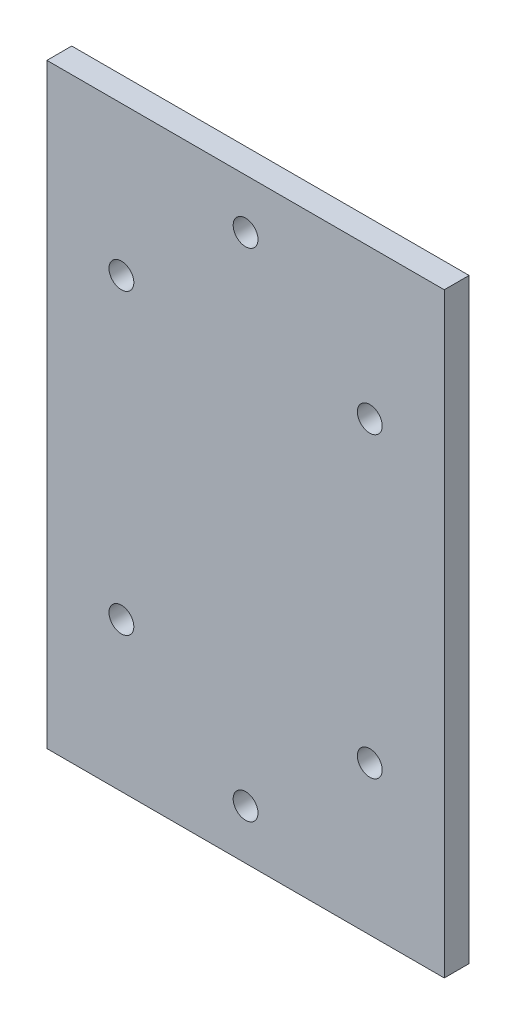
from build123d import *

# Parameters (mm, degrees)
SKETCH2_W           = 40
SKETCH2_H           = 60
SKETCH2_R           = 1.25
BOSS_EXTRUDE2_DEPTH = 2.5


with BuildPart() as part:
    # Sketch2 → Boss-Extrude2 (new body)
    with BuildSketch(Plane.XY):
        Rectangle(SKETCH2_W, SKETCH2_H)
        with Locations((0, 25)):
            Circle(SKETCH2_R, mode=Mode.SUBTRACT)
        with Locations((0, -25)):
            Circle(SKETCH2_R, mode=Mode.SUBTRACT)
        with Locations((12.5, -15)):
            Circle(SKETCH2_R, mode=Mode.SUBTRACT)
        with Locations((-12.5, -15)):
            Circle(SKETCH2_R, mode=Mode.SUBTRACT)
        with Locations((-12.5, 15)):
            Circle(SKETCH2_R, mode=Mode.SUBTRACT)
        with Locations((12.5, 15)):
            Circle(SKETCH2_R, mode=Mode.SUBTRACT)
    extrude(amount=BOSS_EXTRUDE2_DEPTH)


solid = part.part
